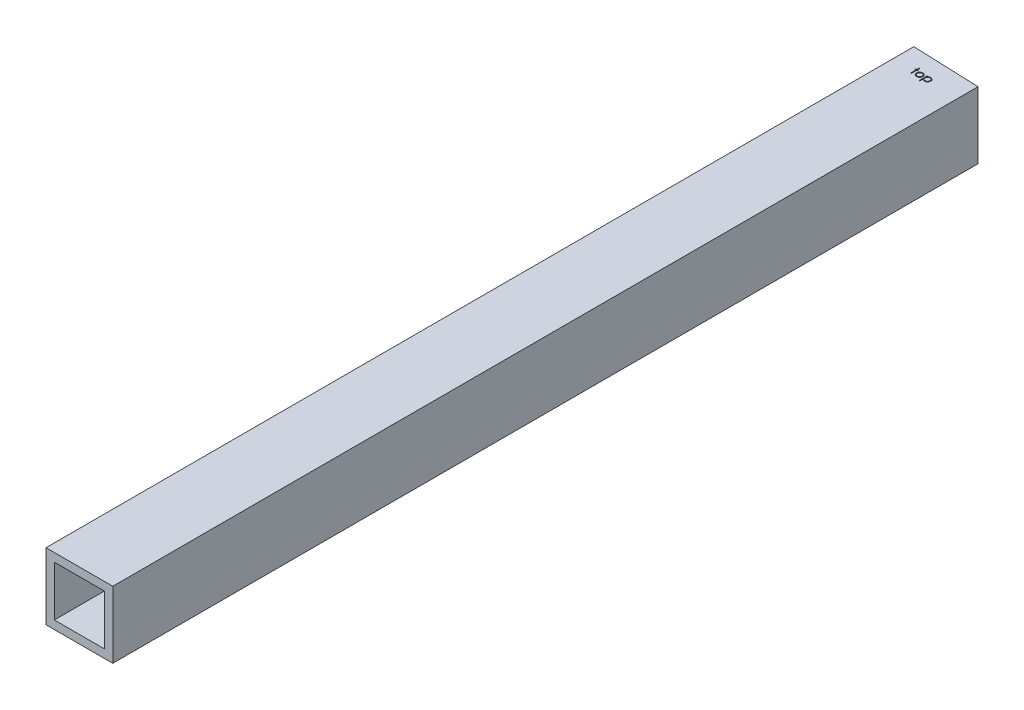
from build123d import *

# Parameters (mm, degrees)
SKETCH2_W           = 25.4
SKETCH2_H           = 25.4
SKETCH2_W_2         = 19.05
SKETCH2_H_2         = 19.05
BOSS_EXTRUDE1_DEPTH = 330.2
CUT_EXTRUDE1_DEPTH  = 333.148099498


with BuildPart() as part:
    # Sketch2 → Boss-Extrude1 (new body)
    with BuildSketch(Plane.XY):
        with Locations((12.7, 12.7)):
            Rectangle(SKETCH2_W, SKETCH2_H)
        with Locations((12.7, 12.7)):
            Rectangle(SKETCH2_W_2, SKETCH2_H_2, mode=Mode.SUBTRACT)
    extrude(amount=BOSS_EXTRUDE1_DEPTH)

    # Sketch3 → Cut-Extrude1 (cut, through all)
    # profile 1 of 4: a face of its own
    with BuildSketch(Plane(origin=(0, 25.4, 0), x_dir=(1, 0, 0), z_dir=(0, 1, 0))):
        Polygon((0, 0), (25.4, -0.977545451), (25.4, 0), align=None)
    # profile 2 of 4: a face of its own
    with BuildSketch(Plane(origin=(0, 25.4, 0), x_dir=(1, 0, 0), z_dir=(0, 1, 0))):
        Polygon((8.067986802, -6.037030809), (8.3529227, -6.037030809), (8.3529227, -6.973248757), (8.759973982, -6.973248757), (8.759973982, -7.258184655), (8.3529227, -7.258184655), (8.3529227, -9.293441065), (8.067986802, -9.293441065), (8.067986802, -7.258184655), (7.66093552, -7.258184655), (7.66093552, -6.973248757), (8.067986802, -6.973248757), align=None)
    # profile 3 of 4: a face of its own
    with BuildSketch(Plane(origin=(0, 25.4, 0), x_dir=(1, 0, 0), z_dir=(0, 1, 0))):
        with BuildLine():
            add(Edge.make_bspline(
                [(10.369098581, -6.932543629), (10.412633521, -6.93347063), (10.4979949, -6.935288253), (10.623006339, -6.954714686), (10.74233657, -6.984421224), (10.856442616, -7.025488998), (10.963863112, -7.080536196), (11.066162741, -7.146221768), (11.163061027, -7.224038835), (11.221139061, -7.284235082), (11.250619014, -7.314790224)],
                knots=[0, 0, 0, 0, 1.054011418, 2.066658804, 3.057071809, 4.030435133, 4.997543892, 5.974964718, 6.972108034, 8, 8, 8, 8], degree=3))
            add(Edge.make_bspline(
                [(11.250619014, -7.314790224), (11.276002644, -7.344012911), (11.32627866, -7.401892746), (11.390745419, -7.495741766), (11.44628212, -7.592933143), (11.490789235, -7.694757503), (11.525882078, -7.800325955), (11.550797388, -7.910001351), (11.565617322, -8.02354148), (11.567615727, -8.100652105), (11.568627828, -8.139705088)],
                knots=[0, 0, 0, 0, 1.025258237, 2.030674902, 3.01204498, 3.988269485, 4.97094183, 5.956517959, 6.965070386, 8, 8, 8, 8], degree=3))
            add(Edge.make_bspline(
                [(11.568627828, -8.139705088), (11.567737615, -8.178984426), (11.565978512, -8.256602229), (11.549338231, -8.370919797), (11.523456461, -8.481767957), (11.48641615, -8.58868263), (11.438919866, -8.691990623), (11.380961885, -8.791240714), (11.312135489, -8.886628721), (11.234117578, -8.977344674), (11.147891947, -9.060952598), (11.05435087, -9.133821813), (10.955332568, -9.196252768), (10.849520383, -9.246541516), (10.737880591, -9.286192459), (10.620172394, -9.314041759), (10.496578652, -9.330879858), (10.412189672, -9.3330421), (10.369098581, -9.334146193)],
                knots=[0, 0, 0, 0, 0.998656419, 1.973391657, 2.932242238, 3.890759089, 4.846373663, 5.82037756, 6.809684879, 7.83454468, 8.860553229, 9.859544525, 10.845671541, 11.83227036, 12.833544569, 13.85385346, 14.904124723, 16, 16, 16, 16], degree=3))
            add(Edge.make_bspline(
                [(10.369098581, -9.334146193), (10.325796371, -9.333038394), (10.240986806, -9.330868713), (10.116956808, -9.314107178), (9.999037653, -9.286205293), (9.887251711, -9.246411211), (9.780984599, -9.19625116), (9.681392563, -9.134010556), (9.587775497, -9.060930987), (9.501531625, -8.97735053), (9.423518604, -8.886627212), (9.354690947, -8.791241106), (9.296733294, -8.691990521), (9.249236923, -8.588682657), (9.212196636, -8.48176795), (9.186314859, -8.370919799), (9.16967458, -8.256602229), (9.167915477, -8.178984425), (9.167025264, -8.139705088)],
                knots=[0, 0, 0, 0, 1.099876186, 2.154163076, 3.173186993, 4.173200201, 5.163417411, 6.152872554, 7.150605724, 8.17532212, 9.198891216, 10.186952605, 11.159729845, 12.11414092, 13.071450619, 14.029093627, 15.002601286, 16, 16, 16, 16], degree=3))
            add(Edge.make_bspline(
                [(9.167025264, -8.139705088), (9.168044267, -8.100864364), (9.170061718, -8.023966406), (9.184866751, -7.910639715), (9.20968487, -7.801149941), (9.244819779, -7.695988973), (9.289737131, -7.594610828), (9.344493442, -7.497179302), (9.409617802, -7.403754655), (9.459693858, -7.345949625), (9.485034078, -7.316698277)],
                knots=[0, 0, 0, 0, 1.031353054, 2.041901799, 3.029428768, 4.008703097, 4.981709435, 5.96992636, 6.972712378, 8, 8, 8, 8], degree=3))
            add(Edge.make_bspline(
                [(9.485034078, -7.316698277), (9.514469585, -7.285878153), (9.572359691, -7.225264957), (9.669740322, -7.147674739), (9.771788288, -7.080622301), (9.8803959, -7.026668877), (9.994408207, -6.98417965), (10.114349948, -6.954638075), (10.239785594, -6.935358246), (10.325564679, -6.933491185), (10.369098581, -6.932543629)],
                knots=[0, 0, 0, 0, 1.027980169, 2.021703884, 2.998553061, 3.971491411, 4.943284454, 5.930300938, 6.949603206, 8, 8, 8, 8], degree=3))
        make_face()
        with BuildLine():
            add(Edge.make_bspline(
                [(10.367826546, -7.217479527), (10.337040284, -7.218354549), (10.276262503, -7.220082005), (10.186800451, -7.233220976), (10.100676169, -7.25403764), (10.01772626, -7.283614177), (9.938230454, -7.321803893), (9.862112639, -7.368710762), (9.789148925, -7.423713516), (9.720766625, -7.486726082), (9.658008385, -7.55555917), (9.60314622, -7.628900181), (9.556496302, -7.70555951), (9.517634158, -7.785616873), (9.48868978, -7.869883562), (9.467668539, -7.957405278), (9.454541963, -8.048360334), (9.452830748, -8.110192115), (9.451961161, -8.14161314)],
                knots=[0, 0, 0, 0, 1.021534396, 2.016698045, 2.994645724, 3.958388632, 4.93408049, 5.916473867, 6.921342795, 7.962252576, 8.998418191, 10.008913653, 10.997312074, 11.973003931, 12.956656626, 13.948281152, 14.957379055, 16, 16, 16, 16], degree=3))
            add(Edge.make_bspline(
                [(9.451961161, -8.14161314), (9.45341878, -8.182209622), (9.45631188, -8.262786047), (9.479838845, -8.381450423), (9.519196399, -8.495371103), (9.572343431, -8.603880253), (9.638933358, -8.70427582), (9.717389483, -8.793784952), (9.806869782, -8.871060652), (9.906307607, -8.935178276), (10.013671881, -8.986123198), (10.127297258, -9.022226554), (10.245807031, -9.045695875), (10.326797408, -9.04802857), (10.367826546, -9.049210296)],
                knots=[0, 0, 0, 0, 1.016792936, 2.018143844, 3.017858371, 4.030088057, 5.03801393, 6.028138512, 7.003788237, 7.991172063, 8.984598303, 9.972568034, 10.972917682, 12, 12, 12, 12], degree=3))
            add(Edge.make_bspline(
                [(10.367826546, -9.049210296), (10.408853323, -9.048021684), (10.489839043, -9.045675399), (10.608184153, -9.022344755), (10.72149897, -8.985965006), (10.828751729, -8.935235572), (10.928144291, -8.870817168), (11.018268136, -8.794221311), (11.096054377, -8.704038746), (11.162578432, -8.603747273), (11.216595835, -8.495539326), (11.255769168, -8.381429397), (11.279352692, -8.262791402), (11.282238158, -8.182211416), (11.28369193, -8.14161314)],
                knots=[0, 0, 0, 0, 1.02726834, 2.027799167, 3.010890988, 4.004497153, 4.992059811, 5.971914811, 6.958719428, 7.966827853, 8.981595046, 9.981490638, 10.983022906, 12, 12, 12, 12], degree=3))
            add(Edge.make_bspline(
                [(11.28369193, -8.14161314), (11.282822643, -8.110191927), (11.281112017, -8.048359777), (11.267981156, -7.957407408), (11.246975774, -7.869875746), (11.21797295, -7.785645714), (11.179279666, -7.705352228), (11.131730146, -7.629125261), (11.077092002, -7.555305109), (11.013576471, -7.486948592), (10.945265549, -7.423688952), (10.872272265, -7.368689434), (10.79626732, -7.322010044), (10.717002463, -7.283287526), (10.634041919, -7.254306724), (10.548038309, -7.23310078), (10.45895796, -7.22013753), (10.398397971, -7.218371194), (10.367826546, -7.217479527)],
                knots=[0, 0, 0, 0, 1.042956736, 2.052379634, 3.044323526, 4.02829302, 5.004299113, 5.996692471, 7.007513377, 8.048758398, 9.090003419, 10.095195979, 11.07790575, 12.047570684, 13.018257071, 13.989683339, 14.985167495, 16, 16, 16, 16], degree=3))
        make_face(mode=Mode.SUBTRACT)
    # profile 4 of 4: a face of its own
    with BuildSketch(Plane(origin=(0, 25.4, 0), x_dir=(1, 0, 0), z_dir=(0, 1, 0))):
        with BuildLine():
            Line((12.138499623, -6.973248757), (12.42343552, -6.973248757))
            Line((12.42343552, -6.973248757), (12.42343552, -7.402560656))
            add(Edge.make_bspline(
                [(12.42343552, -7.402560656), (12.453695524, -7.363609998), (12.512499785, -7.287917188), (12.613850234, -7.189954714), (12.720826696, -7.107336403), (12.836182078, -7.042582248), (12.958123568, -6.993759083), (13.086150742, -6.957673439), (13.221350193, -6.936408673), (13.313784832, -6.933849023), (13.360925504, -6.932543629)],
                knots=[0, 0, 0, 0, 1.0828784, 2.104357462, 3.088488658, 4.04616522, 5.001424249, 5.969181776, 6.964304535, 8, 8, 8, 8], degree=3))
            add(Edge.make_bspline(
                [(13.360925504, -6.932543629), (13.402102173, -6.93373487), (13.483490021, -6.93608942), (13.603290236, -6.952030691), (13.718656477, -6.979351741), (13.828936069, -7.018722571), (13.935310421, -7.067395747), (14.036204754, -7.128824772), (14.133190623, -7.199950388), (14.22382888, -7.281803839), (14.307577549, -7.370366624), (14.380009442, -7.465636857), (14.442486098, -7.564481489), (14.49298701, -7.668432887), (14.532546011, -7.776672474), (14.560680754, -7.88963756), (14.577424473, -8.006909306), (14.579670969, -8.086649631), (14.580807315, -8.126984735)],
                knots=[0, 0, 0, 0, 1.041296284, 2.058176809, 3.050446431, 4.034000596, 5.01514041, 6.003636468, 7.015969324, 8.052561599, 9.08815499, 10.094063707, 11.074456064, 12.040834395, 13.011057502, 13.983766392, 14.980127149, 16, 16, 16, 16], degree=3))
            add(Edge.make_bspline(
                [(14.580807315, -8.126984735), (14.579695625, -8.168171115), (14.577503211, -8.2493966), (14.560498812, -8.368674181), (14.533323648, -8.483416298), (14.494263725, -8.593432102), (14.443788946, -8.698645843), (14.382371238, -8.798981645), (14.3099028, -8.894407361), (14.227079634, -8.983627492), (14.13722447, -9.065814011), (14.041178462, -9.13769426), (13.940432151, -9.198056794), (13.835500971, -9.248478478), (13.725486642, -9.286480674), (13.610902454, -9.313892536), (13.491810792, -9.330796686), (13.41080189, -9.333021129), (13.369829751, -9.334146193)],
                knots=[0, 0, 0, 0, 1.038740735, 2.04854663, 3.033179607, 4.009277356, 4.987731542, 5.972001279, 6.972200261, 8.005528982, 9.039189865, 10.040446548, 11.026516639, 11.997840187, 12.972163198, 13.956796175, 14.96660207, 16, 16, 16, 16], degree=3))
            add(Edge.make_bspline(
                [(13.369829751, -9.334146193), (13.323721882, -9.332971618), (13.232645323, -9.330651487), (13.099478865, -9.307138879), (12.971320578, -9.271998944), (12.84959033, -9.220564857), (12.733323814, -9.155018782), (12.623178705, -9.075090238), (12.518569936, -8.980946386), (12.455606278, -8.909525381), (12.42343552, -8.873033413)],
                knots=[0, 0, 0, 0, 1.014726462, 2.004382257, 2.969841629, 3.936926163, 4.907207904, 5.903978561, 6.929055279, 8, 8, 8, 8], degree=3))
            Line((12.42343552, -8.873033413), (12.42343552, -10.148248757))
            Line((12.42343552, -10.148248757), (12.138499623, -10.148248757))
            Line((12.138499623, -10.148248757), (12.138499623, -6.973248757))
        make_face()
        with BuildLine():
            add(Edge.make_bspline(
                [(13.358381434, -7.217479527), (13.326105688, -7.218060332), (13.262563063, -7.219203789), (13.169424693, -7.2327873), (13.079712412, -7.252506536), (12.994330356, -7.282362331), (12.912460154, -7.319009826), (12.834732376, -7.364804222), (12.761201583, -7.418917113), (12.692052776, -7.480311947), (12.629583932, -7.547961842), (12.574281847, -7.620159355), (12.527829506, -7.696813053), (12.489274102, -7.777208917), (12.459934124, -7.86197714), (12.439110007, -7.950634945), (12.426019615, -8.04327937), (12.424306079, -8.106376604), (12.42343552, -8.138433052)],
                knots=[0, 0, 0, 0, 1.05670511, 2.080379991, 3.077984906, 4.06214886, 5.038337365, 6.01289324, 7.01187578, 8.025460281, 9.038092164, 10.024533457, 11.000252242, 11.969694649, 12.940728589, 13.933144304, 14.949937299, 16, 16, 16, 16], degree=3))
            add(Edge.make_bspline(
                [(12.42343552, -8.138433052), (12.424878654, -8.180513697), (12.427705875, -8.262953245), (12.450690488, -8.383407412), (12.488096763, -8.497391414), (12.541190667, -8.603945355), (12.608271681, -8.701901212), (12.689096437, -8.789613405), (12.782933609, -8.866530584), (12.888223133, -8.931319865), (13.00109178, -8.983923325), (13.118826143, -9.021582644), (13.239807142, -9.044780308), (13.321602689, -9.047725637), (13.362833557, -9.049210296)],
                knots=[0, 0, 0, 0, 1.03728447, 2.032128127, 3.01272805, 3.987917167, 4.958271349, 5.931593992, 6.91984656, 7.941419022, 8.973179163, 9.983609215, 10.983593296, 12, 12, 12, 12], degree=3))
            add(Edge.make_bspline(
                [(13.362833557, -9.049210296), (13.403233861, -9.04779844), (13.483421201, -9.044996159), (13.601493211, -9.020740803), (13.71623829, -8.983688531), (13.825258875, -8.929659505), (13.927605896, -8.863447095), (14.02002702, -8.784017636), (14.100769006, -8.691951759), (14.169588814, -8.589436903), (14.225043804, -8.479513519), (14.266709093, -8.365774688), (14.290756156, -8.24862134), (14.2941641, -8.169701986), (14.295871418, -8.130164823)],
                knots=[0, 0, 0, 0, 1.00104056, 1.986885549, 2.97790532, 3.984399681, 4.995088187, 5.994304198, 6.996462723, 8.023150851, 9.048424203, 10.043036403, 11.019596776, 12, 12, 12, 12], degree=3))
            add(Edge.make_bspline(
                [(14.295871418, -8.130164823), (14.294551766, -8.090382083), (14.291922745, -8.01112655), (14.266026503, -7.894320203), (14.227110095, -7.780121824), (14.170360098, -7.671699611), (14.103048946, -7.569397408), (14.021635599, -7.479087818), (13.930362335, -7.400011564), (13.828137165, -7.3346833), (13.718426922, -7.282717172), (13.602934105, -7.244722728), (13.482244552, -7.221886541), (13.400032322, -7.218961453), (13.358381434, -7.217479527)],
                knots=[0, 0, 0, 0, 0.983928682, 1.960191568, 2.949917689, 3.96440592, 4.982380491, 5.975291189, 6.965713506, 7.964880129, 8.970154049, 9.96478489, 10.968906225, 12, 12, 12, 12], degree=3))
        make_face(mode=Mode.SUBTRACT)
    extrude(amount=-CUT_EXTRUDE1_DEPTH, mode=Mode.SUBTRACT)


with BuildPart() as cut_extrude1_piece_1:
    # of the separate pieces the step leaves, piece 1, a body of its own (cut_extrude1_pieces)
    add(part.part.solids().sort_by_distance((0, 0, 0))[0])


with BuildPart() as cut_extrude1_piece_2:
    # of the separate pieces the step leaves, piece 2, a body of its own (cut_extrude1_pieces)
    add(part.part.solids().sort_by_distance((12.42343552, 0, 8.138433052))[0])


with BuildPart() as cut_extrude1_piece_3:
    # of the separate pieces the step leaves, piece 3, a body of its own (cut_extrude1_pieces)
    add(part.part.solids().sort_by_distance((13.358381434, 25.4, 7.217479527))[0])


with BuildPart() as cut_extrude1_piece_4:
    # of the separate pieces the step leaves, piece 4, a body of its own (cut_extrude1_pieces)
    add(part.part.solids().sort_by_distance((9.451961161, 0, 8.14161314))[0])


with BuildPart() as cut_extrude1_piece_5:
    # of the separate pieces the step leaves, piece 5, a body of its own (cut_extrude1_pieces)
    add(part.part.solids().sort_by_distance((10.367826546, 25.4, 7.217479527))[0])


solid = Compound([cut_extrude1_piece_1.part, cut_extrude1_piece_2.part, cut_extrude1_piece_3.part, cut_extrude1_piece_4.part, cut_extrude1_piece_5.part])
